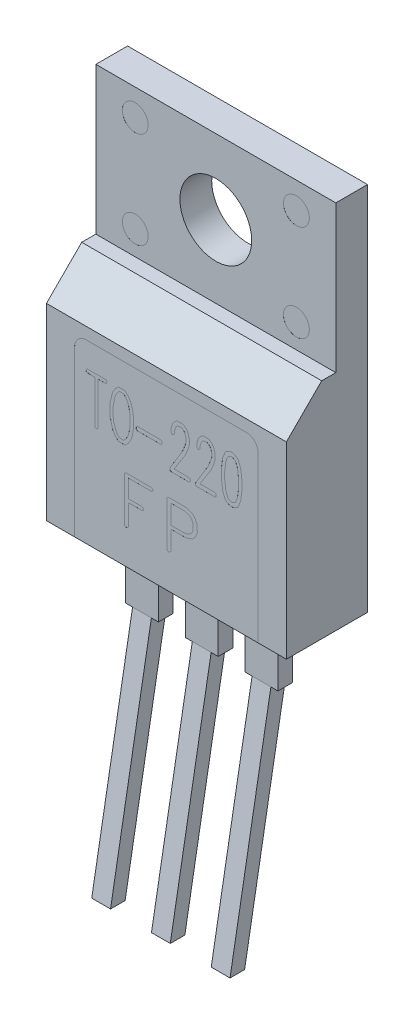
from build123d import *

# Parameters (mm, degrees)
SKETCH1_W           = 10.2
SKETCH1_H           = 15.75
SKETCH1_R           = 1.525
BOSS_EXTRUDE1_DEPTH = 1.35
SKETCH2_W           = 10.2
SKETCH2_H           = 9.5
BOSS_EXTRUDE2_DEPTH = 2.1
CHAMFER1_SIZE       = 1.5
CUT_EXTRUDE1_DEPTH  = 0.001
SKETCH4_W           = 1.4
SKETCH4_H           = 0.62
BOSS_EXTRUDE3_DEPTH = 2.85
SKETCH5_W           = 0.8
SKETCH5_H           = 0.62
BOSS_EXTRUDE4_DEPTH = 10
CUT_EXTRUDE2_DEPTH  = 0.001
SKETCH7_R           = 0.55
CUT_EXTRUDE3_DEPTH  = 0.001


with BuildPart() as part:
    # Sketch1 → Boss-Extrude1 (new body)
    with BuildSketch(Plane.XY):
        Rectangle(SKETCH1_W, SKETCH1_H)
        with Locations(Location((0, 4.7, 0), (0, 0, 180))):
            Circle(SKETCH1_R, mode=Mode.SUBTRACT)
    extrude(amount=BOSS_EXTRUDE1_DEPTH)

    # Sketch2 → Boss-Extrude2 (add)
    with BuildSketch(Plane.XY.offset(1.35)):
        with Locations((0, -3.125)):
            Rectangle(SKETCH2_W, SKETCH2_H)
    extrude(amount=BOSS_EXTRUDE2_DEPTH)

    # Chamfer1
    chamfer1_edges = [part.edges().sort_by_distance(p)[0] for p in [
        (0, 1.625, 3.45),
    ]]
    chamfer(chamfer1_edges, length=CHAMFER1_SIZE)

    # Sketch3 → Cut-Extrude1 (cut)
    with BuildSketch(Plane.XY.offset(3.45)):
        with BuildLine():
            Line((-3.9, -7.875), (3.9, -7.875))
            Line((3.9, -7.875), (3.9, -0.875))
            ThreePointArc((3.9, -0.875), (3.753553391, -0.521446609), (3.4, -0.375))
            Line((3.4, -0.375), (-3.4, -0.375))
            ThreePointArc((-3.4, -0.375), (-3.753553391, -0.521446609), (-3.9, -0.875))
            Line((-3.9, -0.875), (-3.9, -7.875))
        make_face()
    extrude(amount=-CUT_EXTRUDE1_DEPTH, mode=Mode.SUBTRACT)

    # Sketch4 → Boss-Extrude3 (add)
    with BuildSketch(Plane.XZ.offset(7.875)):
        with Locations((-2.54, 1.639)):
            Rectangle(SKETCH4_W, SKETCH4_H)
        with Locations((0, 1.639)):
            Rectangle(SKETCH4_W, SKETCH4_H)
        with Locations((2.54, 1.639)):
            Rectangle(SKETCH4_W, SKETCH4_H)
    extrude(amount=BOSS_EXTRUDE3_DEPTH)

    # Sketch5 → Boss-Extrude4 (add, along a direction that is not the sketch's normal)
    with BuildSketch(Plane.XZ.offset(10.725)):
        with Locations((-2.54, 1.639)):
            Rectangle(SKETCH5_W, SKETCH5_H)
        with Locations((2.54, 1.639)):
            Rectangle(SKETCH5_W, SKETCH5_H)
        with Locations((0, 1.639)):
            Rectangle(SKETCH5_W, SKETCH5_H)
    extrude(amount=BOSS_EXTRUDE4_DEPTH, dir=(0, -0.984807753012208, 0.17364817766693064))

    # Sketch6 → Cut-Extrude2 (cut)
    # profile 1 of 8: a face of its own
    with BuildSketch(Plane.XY.offset(3.449)):
        with BuildLine():
            add(Edge.make_bspline(
                [(-3.337053571, -1.553571429), (-3.344583859, -1.555083796), (-3.358084631, -1.557795263), (-3.376927269, -1.557912121), (-3.392215813, -1.553387595), (-3.405362186, -1.540412883), (-3.414351272, -1.519967594), (-3.41589508, -1.502685243), (-3.416666667, -1.494047619)],
                knots=[0, 0, 0, 0, 1.138141606, 2.040531624, 2.780009125, 3.431502412, 4.71627916, 6, 6, 6, 6], degree=3))
            add(Edge.make_bspline(
                [(-3.416666667, -1.494047619), (-3.415955255, -1.485487162), (-3.414521596, -1.468235861), (-3.404666849, -1.448597093), (-3.394260846, -1.435081439), (-3.38431118, -1.427810635), (-3.37298055, -1.423460993), (-3.36499444, -1.422906102), (-3.360863095, -1.422619048)],
                knots=[0, 0, 0, 0, 1.528507809, 3.080296578, 3.85483527, 4.570982135, 5.260745705, 6, 6, 6, 6], degree=3))
            Line((-3.360863095, -1.422619048), (-2.613467262, -1.422619048))
            add(Edge.make_bspline(
                [(-2.613467262, -1.422619048), (-2.606485162, -1.422815125), (-2.59355828, -1.423178148), (-2.575825567, -1.428053473), (-2.561244351, -1.436313287), (-2.548533817, -1.451534048), (-2.537353697, -1.470515), (-2.535182119, -1.48685483), (-2.53422619, -1.494047619)],
                knots=[0, 0, 0, 0, 1.05057451, 1.945067327, 2.750578307, 3.532262753, 4.913702687, 6, 6, 6, 6], degree=3))
            add(Edge.make_bspline(
                [(-2.53422619, -1.494047619), (-2.535175637, -1.501359799), (-2.537312403, -1.517816137), (-2.548355556, -1.536974442), (-2.56138378, -1.551775043), (-2.575807789, -1.560057824), (-2.593563867, -1.564912043), (-2.606487122, -1.565278344), (-2.613467262, -1.56547619)],
                knots=[0, 0, 0, 0, 1.103831219, 2.484213998, 3.251526589, 4.056421147, 4.950229448, 6, 6, 6, 6], degree=3))
            Line((-2.613467262, -1.56547619), (-2.904761905, -1.56547619))
            Line((-2.904761905, -1.56547619), (-2.904761905, -3.345238095))
            add(Edge.make_bspline(
                [(-2.904761905, -3.345238095), (-2.905783203, -3.353312761), (-2.908067564, -3.371373542), (-2.920112704, -3.39210117), (-2.93369168, -3.4082686), (-2.948913179, -3.41688488), (-2.967479812, -3.421576529), (-2.980872483, -3.422253794), (-2.988095238, -3.422619048)],
                knots=[0, 0, 0, 0, 1.142200586, 2.554785099, 3.31231341, 4.106525294, 4.978836614, 6, 6, 6, 6], degree=3))
            add(Edge.make_bspline(
                [(-2.988095238, -3.422619048), (-2.992477514, -3.422356854), (-3.000994974, -3.421847252), (-3.012982756, -3.417136995), (-3.023333729, -3.409295729), (-3.035092846, -3.395314638), (-3.0451181, -3.373493005), (-3.046786339, -3.354645774), (-3.047619048, -3.345238095)],
                knots=[0, 0, 0, 0, 0.726822302, 1.412663379, 2.105912496, 2.866784857, 4.436041716, 6, 6, 6, 6], degree=3))
            Line((-3.047619048, -3.345238095), (-3.047619048, -1.56547619))
            Line((-3.047619048, -1.56547619), (-3.313244048, -1.56547619))
            Line((-3.313244048, -1.56547619), (-3.337053571, -1.553571429))
        make_face()
    # profile 2 of 8: a face of its own
    with BuildSketch(Plane.XY.offset(3.449)):
        with BuildLine():
            add(Edge.make_bspline(
                [(-1.52641369, -1.713541667), (-1.521569557, -1.721139903), (-1.513281033, -1.734140818), (-1.509417878, -1.749023616), (-1.5078125, -1.755208333)],
                knots=[0, 0, 0, 0, 1.168877111, 2, 2, 2, 2], degree=3))
            Line((-1.5078125, -1.755208333), (-1.45610119, -1.905505952))
            Line((-1.45610119, -1.905505952), (-1.453869048, -1.909970238))
            add(Edge.make_bspline(
                [(-1.453869048, -1.909970238), (-1.452063818, -1.915881011), (-1.449118709, -1.925524034), (-1.447715658, -1.935499284), (-1.447172619, -1.939360119)],
                knots=[0, 0, 0, 0, 1.225917069, 2, 2, 2, 2], degree=3))
            Line((-1.447172619, -1.939360119), (-1.405133929, -2.181547619))
            add(Edge.make_bspline(
                [(-1.405133929, -2.181547619), (-1.404978098, -2.186383521), (-1.404674476, -2.195805821), (-1.404733281, -2.205232768), (-1.404761905, -2.209821429)],
                knots=[0, 0, 0, 0, 1.026479987, 2, 2, 2, 2], degree=3))
            Line((-1.404761905, -2.209821429), (-1.404761905, -2.635416667))
            add(Edge.make_bspline(
                [(-1.404761905, -2.635416667), (-1.404761905, -2.640252976), (-1.404761905, -2.648933532), (-1.404761905, -2.657614087), (-1.404761905, -2.661458333)],
                knots=[0, 0, 0, 0, 1.114285714, 2, 2, 2, 2], degree=3))
            Line((-1.404761905, -2.661458333), (-1.447544643, -2.911458333))
            add(Edge.make_bspline(
                [(-1.447544643, -2.911458333), (-1.448071758, -2.915076164), (-1.44923368, -2.923050959), (-1.451750148, -2.930710891), (-1.453125, -2.934895833)],
                knots=[0, 0, 0, 0, 0.907316161, 2, 2, 2, 2], degree=3))
            Line((-1.453125, -2.934895833), (-1.453497024, -2.936755952))
            Line((-1.453497024, -2.936755952), (-1.509672619, -3.099702381))
            add(Edge.make_bspline(
                [(-1.509672619, -3.099702381), (-1.511691149, -3.105142077), (-1.515068691, -3.114244148), (-1.520240473, -3.122444496), (-1.522321429, -3.125744048)],
                knots=[0, 0, 0, 0, 1.195265482, 2, 2, 2, 2], degree=3))
            Line((-1.522321429, -3.125744048), (-1.624255952, -3.292782738))
            add(Edge.make_bspline(
                [(-1.624255952, -3.292782738), (-1.62723118, -3.299355902), (-1.632872287, -3.311818787), (-1.645210746, -3.317586696), (-1.651041667, -3.3203125)],
                knots=[0, 0, 0, 0, 1.054838137, 2, 2, 2, 2], degree=3))
            Line((-1.651041667, -3.3203125), (-1.73139881, -3.390625))
            add(Edge.make_bspline(
                [(-1.73139881, -3.390625), (-1.734537434, -3.395659865), (-1.740792772, -3.405694444), (-1.756766619, -3.415360622), (-1.775867415, -3.422082236), (-1.790225752, -3.422430629), (-1.797991071, -3.422619048)],
                knots=[0, 0, 0, 0, 0.90300958, 1.799714995, 2.810035161, 4, 4, 4, 4], degree=3))
            Line((-1.797991071, -3.422619048), (-2.022693452, -3.422619048))
            add(Edge.make_bspline(
                [(-2.022693452, -3.422619048), (-2.027709633, -3.422288731), (-2.037186463, -3.42166468), (-2.050112034, -3.416239842), (-2.060400224, -3.407172238), (-2.064716239, -3.399227431), (-2.066964286, -3.395089286)],
                knots=[0, 0, 0, 0, 1.085042538, 2.049918853, 2.984277492, 4, 4, 4, 4], degree=3))
            Line((-2.066964286, -3.395089286), (-2.147693452, -3.324404762))
            add(Edge.make_bspline(
                [(-2.147693452, -3.324404762), (-2.150402352, -3.323464237), (-2.156134086, -3.321474188), (-2.163143173, -3.314428255), (-2.169950469, -3.30551817), (-2.173379568, -3.29820353), (-2.175223214, -3.294270833)],
                knots=[0, 0, 0, 0, 0.807126528, 1.707791034, 2.767600087, 4, 4, 4, 4], degree=3))
            Line((-2.175223214, -3.294270833), (-2.2734375, -3.133928571))
            add(Edge.make_bspline(
                [(-2.2734375, -3.133928571), (-2.277965155, -3.127710393), (-2.287061572, -3.115217583), (-2.289384089, -3.099936815), (-2.290550595, -3.092261905)],
                knots=[0, 0, 0, 0, 0.995481035, 2, 2, 2, 2], degree=3))
            Line((-2.290550595, -3.092261905), (-2.33296131, -2.939360119))
            add(Edge.make_bspline(
                [(-2.33296131, -2.939360119), (-2.333116325, -2.934648225), (-2.333426302, -2.925226069), (-2.333364319, -2.915799019), (-2.333333333, -2.91108631)],
                knots=[0, 0, 0, 0, 1.00017307, 2, 2, 2, 2], degree=3))
            Line((-2.333333333, -2.91108631), (-2.404389881, -2.668526786))
            add(Edge.make_bspline(
                [(-2.404389881, -2.668526786), (-2.404543154, -2.663318801), (-2.404867897, -2.652284484), (-2.404798531, -2.641245476), (-2.404761905, -2.635416667)],
                knots=[0, 0, 0, 0, 0.943961462, 2, 2, 2, 2], degree=3))
            Line((-2.404761905, -2.635416667), (-2.404761905, -2.209821429))
            add(Edge.make_bspline(
                [(-2.404761905, -2.209821429), (-2.404761905, -2.204985119), (-2.404761905, -2.194816468), (-2.404761905, -2.184647817), (-2.404761905, -2.179315476)],
                knots=[0, 0, 0, 0, 0.951219512, 2, 2, 2, 2], degree=3))
            Line((-2.404761905, -2.179315476), (-2.33296131, -1.937872024))
            add(Edge.make_bspline(
                [(-2.33296131, -1.937872024), (-2.333114363, -1.933284123), (-2.333441089, -1.923490235), (-2.333370732, -1.913690981), (-2.333333333, -1.908482143)],
                knots=[0, 0, 0, 0, 0.93689068, 2, 2, 2, 2], degree=3))
            Line((-2.333333333, -1.908482143), (-2.290550595, -1.754092262))
            add(Edge.make_bspline(
                [(-2.290550595, -1.754092262), (-2.289422524, -1.746157998), (-2.287235218, -1.730773621), (-2.278189869, -1.718161284), (-2.273809524, -1.712053571)],
                knots=[0, 0, 0, 0, 1.031470231, 2, 2, 2, 2], degree=3))
            Line((-2.273809524, -1.712053571), (-2.175967262, -1.552455357))
            add(Edge.make_bspline(
                [(-2.175967262, -1.552455357), (-2.172375166, -1.546111687), (-2.165712415, -1.534345214), (-2.15388732, -1.527897258), (-2.1484375, -1.524925595)],
                knots=[0, 0, 0, 0, 1.078261996, 2, 2, 2, 2], degree=3))
            Line((-2.1484375, -1.524925595), (-2.066964286, -1.450892857))
            add(Edge.make_bspline(
                [(-2.066964286, -1.450892857), (-2.064713149, -1.44664404), (-2.06039779, -1.438499187), (-2.050242823, -1.428969593), (-2.0371713, -1.423591128), (-2.027704385, -1.422955495), (-2.022693452, -1.422619048)],
                knots=[0, 0, 0, 0, 1.028115026, 1.970864985, 2.925958555, 4, 4, 4, 4], degree=3))
            Line((-2.022693452, -1.422619048), (-1.797991071, -1.422619048))
            add(Edge.make_bspline(
                [(-1.797991071, -1.422619048), (-1.79025041, -1.423007995), (-1.775829214, -1.423732621), (-1.756042842, -1.43003755), (-1.740139164, -1.441146508), (-1.733568214, -1.451612328), (-1.730282738, -1.456845238)],
                knots=[0, 0, 0, 0, 1.159625116, 2.160432893, 3.080216446, 4, 4, 4, 4], degree=3))
            Line((-1.730282738, -1.456845238), (-1.66108631, -1.525297619))
            add(Edge.make_bspline(
                [(-1.66108631, -1.525297619), (-1.653708193, -1.528191047), (-1.639575934, -1.533733203), (-1.630216935, -1.545645917), (-1.625744048, -1.551339286)],
                knots=[0, 0, 0, 0, 1.044152526, 2, 2, 2, 2], degree=3))
            Line((-1.625744048, -1.551339286), (-1.52641369, -1.713541667))
        make_face()
        Polygon((-1.735491071, -3.196800595), (-1.647693452, -3.049479167), (-1.593377976, -2.889508929), (-1.592633929, -2.88764881), (-1.547619048, -2.625744048), (-1.547619048, -2.219122024), (-1.59077381, -1.963169643), (-1.592261905, -1.962797619), (-1.647693452, -1.796130952), (-1.735863095, -1.648065476), (-1.82328869, -1.56547619), (-1.99516369, -1.56547619), (-2.073660714, -1.640997024), (-2.161458333, -1.788690476), (-2.230654762, -1.97172619), (-2.212425595, -1.980282738), (-2.261904762, -2.216145833), (-2.261904762, -2.629464286), (-2.231770833, -2.874627976), (-2.212797619, -2.864955357), (-2.16108631, -3.05766369), (-2.07328869, -3.204985119), (-1.99516369, -3.279761905), (-1.822916667, -3.279761905), align=None, mode=Mode.SUBTRACT)
    # profile 3 of 8: a face of its own
    with BuildSketch(Plane.XY.offset(3.449)):
        with BuildLine():
            add(Edge.make_bspline(
                [(-0.242559524, -2.470238095), (-0.236737568, -2.474185635), (-0.226183932, -2.481341459), (-0.213272553, -2.493136944), (-0.203729622, -2.504047557), (-0.200480381, -2.512056677), (-0.199032738, -2.515625)],
                knots=[0, 0, 0, 0, 1.31724091, 2.387802413, 3.2817136, 4, 4, 4, 4], degree=3))
            add(Edge.make_bspline(
                [(-0.199032738, -2.515625), (-0.196583303, -2.521121284), (-0.191620176, -2.532258038), (-0.190860796, -2.544430307), (-0.19047619, -2.550595238)],
                knots=[0, 0, 0, 0, 0.987053187, 2, 2, 2, 2], degree=3))
            add(Edge.make_bspline(
                [(-0.19047619, -2.550595238), (-0.19091643, -2.557681294), (-0.191839981, -2.572546708), (-0.196058783, -2.591268526), (-0.203257081, -2.606628522), (-0.213554845, -2.617296254), (-0.227165503, -2.627886404), (-0.238106154, -2.633730856), (-0.244047619, -2.636904762)],
                knots=[0, 0, 0, 0, 1.174378568, 2.463658788, 3.152065413, 3.951460674, 4.88751369, 6, 6, 6, 6], degree=3))
            Line((-0.244047619, -2.636904762), (-1.241071429, -2.636532738))
            add(Edge.make_bspline(
                [(-1.241071429, -2.636532738), (-1.24734748, -2.634300762), (-1.259764182, -2.629884964), (-1.273213436, -2.613896934), (-1.282931233, -2.593493896), (-1.284733205, -2.577520886), (-1.285714286, -2.568824405)],
                knots=[0, 0, 0, 0, 0.906075189, 1.792602544, 2.798185721, 4, 4, 4, 4], degree=3))
            add(Edge.make_bspline(
                [(-1.285714286, -2.568824405), (-1.285451022, -2.55972433), (-1.284953893, -2.542540389), (-1.278797169, -2.518739719), (-1.269464146, -2.498196875), (-1.259605446, -2.487878439), (-1.25483631, -2.482886905)],
                knots=[0, 0, 0, 0, 1.159043221, 2.188655717, 3.123763861, 4, 4, 4, 4], degree=3))
            add(Edge.make_bspline(
                [(-1.25483631, -2.482886905), (-1.253129302, -2.481118925), (-1.248728791, -2.476561234), (-1.243748056, -2.472638907), (-1.240699405, -2.470238095)],
                knots=[0, 0, 0, 0, 0.775822661, 2, 2, 2, 2], degree=3))
            Line((-1.240699405, -2.470238095), (-0.242559524, -2.470238095))
        make_face()
    # profile 4 of 8: a face of its own
    with BuildSketch(Plane.XY.offset(3.449)):
        with BuildLine():
            add(Edge.make_bspline(
                [(0.712797619, -1.425967262), (0.721071724, -1.432830569), (0.739542685, -1.448152091), (0.771108883, -1.472560513), (0.80836802, -1.501946549), (0.835535865, -1.522731405), (0.850074405, -1.533854167)],
                knots=[0, 0, 0, 0, 0.738755888, 1.649185221, 2.741990243, 4, 4, 4, 4], degree=3))
            add(Edge.make_bspline(
                [(0.850074405, -1.533854167), (0.857193904, -1.544858282), (0.873047273, -1.569361735), (0.892477062, -1.601527844), (0.908350096, -1.629507045), (0.918728797, -1.650289613), (0.925710778, -1.670383689), (0.928912669, -1.683506895), (0.930431548, -1.689732143)],
                knots=[0, 0, 0, 0, 1.337769255, 2.978882237, 3.834564883, 4.621482691, 5.346073539, 6, 6, 6, 6], degree=3))
            add(Edge.make_bspline(
                [(0.930431548, -1.689732143), (0.933181977, -1.698157575), (0.939596437, -1.717807084), (0.949886734, -1.751418374), (0.962103289, -1.793424669), (0.971211364, -1.824038271), (0.976190476, -1.84077381)],
                knots=[0, 0, 0, 0, 0.673862802, 1.571560152, 2.672444651, 4, 4, 4, 4], degree=3))
            Line((0.976190476, -1.84077381), (0.976190476, -2.039434524))
            add(Edge.make_bspline(
                [(0.976190476, -2.039434524), (0.975101474, -2.043286997), (0.972561426, -2.052272711), (0.967474239, -2.067373762), (0.962215138, -2.086520139), (0.954811778, -2.109036734), (0.94732854, -2.13562538), (0.93777712, -2.16548407), (0.927877074, -2.199333473), (0.92054654, -2.222977084), (0.916666667, -2.235491071)],
                knots=[0, 0, 0, 0, 0.468874405, 1.093627666, 1.865790236, 2.793814149, 3.869268999, 5.100575786, 6.465405363, 8, 8, 8, 8], degree=3))
            Line((0.916666667, -2.235491071), (0.802455357, -2.5078125))
            Line((0.802455357, -2.5078125), (0.329241071, -3.255952381))
            Line((0.329241071, -3.255952381), (0.962425595, -3.255952381))
            add(Edge.make_bspline(
                [(0.962425595, -3.255952381), (0.971316041, -3.261097314), (0.987996452, -3.270750327), (1.006936243, -3.291269739), (1.019316901, -3.314861065), (1.020323936, -3.332069239), (1.020833333, -3.34077381)],
                knots=[0, 0, 0, 0, 1.127991252, 2.116356953, 3.047179272, 4, 4, 4, 4], degree=3))
            add(Edge.make_bspline(
                [(1.020833333, -3.34077381), (1.019685126, -3.34761406), (1.016927856, -3.364040038), (1.012581216, -3.380123237), (1.010044643, -3.389508929)],
                knots=[0, 0, 0, 0, 0.832857648, 2, 2, 2, 2], degree=3))
            add(Edge.make_bspline(
                [(1.010044643, -3.389508929), (1.00702498, -3.394628813), (1.00094897, -3.404930779), (0.985445664, -3.415491928), (0.966324226, -3.421430631), (0.952430831, -3.422202766), (0.944940476, -3.422619048)],
                knots=[0, 0, 0, 0, 0.915320197, 1.841760097, 2.836426763, 4, 4, 4, 4], degree=3))
            Line((0.944940476, -3.422619048), (0.183407738, -3.422619048))
            add(Edge.make_bspline(
                [(0.183407738, -3.422619048), (0.177812532, -3.419610613), (0.166502935, -3.413529661), (0.15382021, -3.397462926), (0.145616222, -3.376553009), (0.143826435, -3.360824571), (0.142857143, -3.352306548)],
                knots=[0, 0, 0, 0, 0.883706095, 1.786236404, 2.801095743, 4, 4, 4, 4], degree=3))
            add(Edge.make_bspline(
                [(0.142857143, -3.352306548), (0.143495797, -3.339805127), (0.14473152, -3.315616334), (0.155507583, -3.293950493), (0.160714286, -3.283482143)],
                knots=[0, 0, 0, 0, 1.033653998, 2, 2, 2, 2], degree=3))
            Line((0.160714286, -3.283482143), (0.686383929, -2.420386905))
            Line((0.686383929, -2.420386905), (0.7890625, -2.162946429))
            Line((0.7890625, -2.162946429), (0.833333333, -2.018229167))
            Line((0.833333333, -2.018229167), (0.833333333, -1.876488095))
            Line((0.833333333, -1.876488095), (0.786458333, -1.725446429))
            Line((0.786458333, -1.725446429), (0.747395833, -1.658482143))
            Line((0.747395833, -1.658482143), (0.659970238, -1.589285714))
            Line((0.659970238, -1.589285714), (0.494791667, -1.589285714))
            Line((0.494791667, -1.589285714), (0.419270833, -1.651785714))
            Line((0.419270833, -1.651785714), (0.380580357, -1.716517857))
            Line((0.380580357, -1.716517857), (0.334077381, -1.870907738))
            Line((0.334077381, -1.870907738), (0.334077381, -1.933779762))
            add(Edge.make_bspline(
                [(0.334077381, -1.933779762), (0.33374097, -1.941420313), (0.333078192, -1.956473288), (0.324971687, -1.977704016), (0.312989948, -1.997361234), (0.301628556, -2.007931796), (0.295758929, -2.013392857)],
                knots=[0, 0, 0, 0, 0.999430391, 1.969020288, 2.950736492, 4, 4, 4, 4], degree=3))
            add(Edge.make_bspline(
                [(0.295758929, -2.013392857), (0.288121108, -2.015733333), (0.274584737, -2.019881316), (0.260570896, -2.021839961), (0.254464286, -2.022693452)],
                knots=[0, 0, 0, 0, 1.128488755, 2, 2, 2, 2], degree=3))
            add(Edge.make_bspline(
                [(0.254464286, -2.022693452), (0.249953065, -2.022589007), (0.24145158, -2.022392177), (0.229993388, -2.018027853), (0.220377992, -2.011539361), (0.216096978, -2.005375611), (0.21391369, -2.002232143)],
                knots=[0, 0, 0, 0, 1.128025163, 2.125785883, 3.044164124, 4, 4, 4, 4], degree=3))
            add(Edge.make_bspline(
                [(0.21391369, -2.002232143), (0.21064577, -1.997532578), (0.203427027, -1.987151375), (0.198528698, -1.966577558), (0.193961069, -1.941806715), (0.193872773, -1.923401051), (0.193824405, -1.913318452)],
                knots=[0, 0, 0, 0, 0.735272304, 1.624195484, 2.698537447, 4, 4, 4, 4], degree=3))
            add(Edge.make_bspline(
                [(0.193824405, -1.913318452), (0.195254151, -1.912473433), (0.19795684, -1.91087607), (0.199049327, -1.905696939), (0.197629034, -1.899908841), (0.195211492, -1.896137218), (0.193824405, -1.893973214)],
                knots=[0, 0, 0, 0, 0.85238152, 1.611280165, 2.62944954, 4, 4, 4, 4], degree=3))
            add(Edge.make_bspline(
                [(0.193824405, -1.893973214), (0.194258055, -1.884178191), (0.195081201, -1.865585514), (0.195238208, -1.8469755), (0.1953125, -1.838169643)],
                knots=[0, 0, 0, 0, 1.053643116, 2, 2, 2, 2], degree=3))
            add(Edge.make_bspline(
                [(0.1953125, -1.838169643), (0.199165068, -1.825399317), (0.207652386, -1.797265926), (0.221290486, -1.751345048), (0.237356592, -1.697880712), (0.248990254, -1.659840861), (0.255208333, -1.639508929)],
                knots=[0, 0, 0, 0, 0.771421305, 1.699463078, 2.770385237, 4, 4, 4, 4], degree=3))
            add(Edge.make_bspline(
                [(0.255208333, -1.639508929), (0.262582703, -1.626449449), (0.276848727, -1.601185346), (0.291856948, -1.576355137), (0.299107143, -1.564360119)],
                knots=[0, 0, 0, 0, 1.033836784, 2, 2, 2, 2], degree=3))
            add(Edge.make_bspline(
                [(0.299107143, -1.564360119), (0.304066946, -1.55657992), (0.313257967, -1.542162417), (0.327603119, -1.523709927), (0.340881795, -1.50934686), (0.350804323, -1.503419356), (0.355282738, -1.500744048)],
                knots=[0, 0, 0, 0, 1.289706312, 2.389957182, 3.273326239, 4, 4, 4, 4], degree=3))
            Line((0.355282738, -1.500744048), (0.445684524, -1.428943452))
            Line((0.445684524, -1.428943452), (0.462053571, -1.422991071))
            Line((0.462053571, -1.422991071), (0.712797619, -1.425967262))
        make_face()
    # profile 5 of 8: a face of its own
    with BuildSketch(Plane.XY.offset(3.449)):
        with BuildLine():
            add(Edge.make_bspline(
                [(1.808035714, -1.425967262), (1.816309819, -1.432830569), (1.83478078, -1.448152091), (1.866346978, -1.472560513), (1.903606116, -1.501946549), (1.93077396, -1.522731405), (1.9453125, -1.533854167)],
                knots=[0, 0, 0, 0, 0.738755888, 1.649185221, 2.741990243, 4, 4, 4, 4], degree=3))
            add(Edge.make_bspline(
                [(1.9453125, -1.533854167), (1.952431999, -1.544858282), (1.968285368, -1.569361735), (1.987715157, -1.601527844), (2.003588191, -1.629507045), (2.013966892, -1.650289613), (2.020948873, -1.670383689), (2.024150764, -1.683506895), (2.025669643, -1.689732143)],
                knots=[0, 0, 0, 0, 1.337769255, 2.978882237, 3.834564883, 4.621482691, 5.346073539, 6, 6, 6, 6], degree=3))
            add(Edge.make_bspline(
                [(2.025669643, -1.689732143), (2.028420073, -1.698157575), (2.034834533, -1.717807084), (2.045124829, -1.751418374), (2.057341385, -1.793424669), (2.06644946, -1.824038271), (2.071428571, -1.84077381)],
                knots=[0, 0, 0, 0, 0.673862802, 1.571560152, 2.672444651, 4, 4, 4, 4], degree=3))
            Line((2.071428571, -1.84077381), (2.071428571, -2.039434524))
            add(Edge.make_bspline(
                [(2.071428571, -2.039434524), (2.070339569, -2.043286997), (2.067799522, -2.052272711), (2.062712334, -2.067373762), (2.057453234, -2.086520139), (2.050049873, -2.109036734), (2.042566636, -2.13562538), (2.033015215, -2.16548407), (2.023115169, -2.199333473), (2.015784635, -2.222977084), (2.011904762, -2.235491071)],
                knots=[0, 0, 0, 0, 0.468874405, 1.093627666, 1.865790236, 2.793814149, 3.869268999, 5.100575786, 6.465405363, 8, 8, 8, 8], degree=3))
            Line((2.011904762, -2.235491071), (1.897693452, -2.5078125))
            Line((1.897693452, -2.5078125), (1.424479167, -3.255952381))
            Line((1.424479167, -3.255952381), (2.05766369, -3.255952381))
            add(Edge.make_bspline(
                [(2.05766369, -3.255952381), (2.066554137, -3.261097314), (2.083234548, -3.270750327), (2.102174338, -3.291269739), (2.114554997, -3.314861065), (2.115562031, -3.332069239), (2.116071429, -3.34077381)],
                knots=[0, 0, 0, 0, 1.127991252, 2.116356953, 3.047179272, 4, 4, 4, 4], degree=3))
            add(Edge.make_bspline(
                [(2.116071429, -3.34077381), (2.114923222, -3.34761406), (2.112165951, -3.364040038), (2.107819312, -3.380123237), (2.105282738, -3.389508929)],
                knots=[0, 0, 0, 0, 0.832857648, 2, 2, 2, 2], degree=3))
            add(Edge.make_bspline(
                [(2.105282738, -3.389508929), (2.102263075, -3.394628813), (2.096187066, -3.404930779), (2.080683759, -3.415491928), (2.061562321, -3.421430631), (2.047668926, -3.422202766), (2.040178571, -3.422619048)],
                knots=[0, 0, 0, 0, 0.915320197, 1.841760097, 2.836426763, 4, 4, 4, 4], degree=3))
            Line((2.040178571, -3.422619048), (1.278645833, -3.422619048))
            add(Edge.make_bspline(
                [(1.278645833, -3.422619048), (1.273050627, -3.419610613), (1.26174103, -3.413529661), (1.249058306, -3.397462926), (1.240854317, -3.376553009), (1.23906453, -3.360824571), (1.238095238, -3.352306548)],
                knots=[0, 0, 0, 0, 0.883706095, 1.786236404, 2.801095743, 4, 4, 4, 4], degree=3))
            add(Edge.make_bspline(
                [(1.238095238, -3.352306548), (1.238733893, -3.339805127), (1.239969615, -3.315616334), (1.250745678, -3.293950493), (1.255952381, -3.283482143)],
                knots=[0, 0, 0, 0, 1.033653998, 2, 2, 2, 2], degree=3))
            Line((1.255952381, -3.283482143), (1.781622024, -2.420386905))
            Line((1.781622024, -2.420386905), (1.884300595, -2.162946429))
            Line((1.884300595, -2.162946429), (1.928571429, -2.018229167))
            Line((1.928571429, -2.018229167), (1.928571429, -1.876488095))
            Line((1.928571429, -1.876488095), (1.881696429, -1.725446429))
            Line((1.881696429, -1.725446429), (1.842633929, -1.658482143))
            Line((1.842633929, -1.658482143), (1.755208333, -1.589285714))
            Line((1.755208333, -1.589285714), (1.590029762, -1.589285714))
            Line((1.590029762, -1.589285714), (1.514508929, -1.651785714))
            Line((1.514508929, -1.651785714), (1.475818452, -1.716517857))
            Line((1.475818452, -1.716517857), (1.429315476, -1.870907738))
            Line((1.429315476, -1.870907738), (1.429315476, -1.933779762))
            add(Edge.make_bspline(
                [(1.429315476, -1.933779762), (1.428979065, -1.941420313), (1.428316287, -1.956473288), (1.420209782, -1.977704016), (1.408228044, -1.997361234), (1.396866651, -2.007931796), (1.390997024, -2.013392857)],
                knots=[0, 0, 0, 0, 0.999430391, 1.969020288, 2.950736492, 4, 4, 4, 4], degree=3))
            add(Edge.make_bspline(
                [(1.390997024, -2.013392857), (1.383359203, -2.015733333), (1.369822832, -2.019881316), (1.355808991, -2.021839961), (1.349702381, -2.022693452)],
                knots=[0, 0, 0, 0, 1.128488755, 2, 2, 2, 2], degree=3))
            add(Edge.make_bspline(
                [(1.349702381, -2.022693452), (1.34519116, -2.022589007), (1.336689675, -2.022392177), (1.325231484, -2.018027853), (1.315616088, -2.011539361), (1.311335073, -2.005375611), (1.309151786, -2.002232143)],
                knots=[0, 0, 0, 0, 1.128025163, 2.125785883, 3.044164124, 4, 4, 4, 4], degree=3))
            add(Edge.make_bspline(
                [(1.309151786, -2.002232143), (1.305883865, -1.997532578), (1.298665123, -1.987151375), (1.293766793, -1.966577558), (1.289199165, -1.941806715), (1.289110868, -1.923401051), (1.2890625, -1.913318452)],
                knots=[0, 0, 0, 0, 0.735272304, 1.624195484, 2.698537447, 4, 4, 4, 4], degree=3))
            add(Edge.make_bspline(
                [(1.2890625, -1.913318452), (1.290492246, -1.912473433), (1.293194935, -1.91087607), (1.294287422, -1.905696939), (1.292867129, -1.899908841), (1.290449587, -1.896137218), (1.2890625, -1.893973214)],
                knots=[0, 0, 0, 0, 0.85238152, 1.611280165, 2.62944954, 4, 4, 4, 4], degree=3))
            add(Edge.make_bspline(
                [(1.2890625, -1.893973214), (1.289496151, -1.884178191), (1.290319296, -1.865585514), (1.290476303, -1.8469755), (1.290550595, -1.838169643)],
                knots=[0, 0, 0, 0, 1.053643116, 2, 2, 2, 2], degree=3))
            add(Edge.make_bspline(
                [(1.290550595, -1.838169643), (1.294403163, -1.825399317), (1.302890481, -1.797265926), (1.316528581, -1.751345048), (1.332594688, -1.697880712), (1.344228349, -1.659840861), (1.350446429, -1.639508929)],
                knots=[0, 0, 0, 0, 0.771421305, 1.699463078, 2.770385237, 4, 4, 4, 4], degree=3))
            add(Edge.make_bspline(
                [(1.350446429, -1.639508929), (1.357820799, -1.626449449), (1.372086822, -1.601185346), (1.387095043, -1.576355137), (1.394345238, -1.564360119)],
                knots=[0, 0, 0, 0, 1.033836784, 2, 2, 2, 2], degree=3))
            add(Edge.make_bspline(
                [(1.394345238, -1.564360119), (1.399305042, -1.55657992), (1.408496063, -1.542162417), (1.422841214, -1.523709927), (1.43611989, -1.50934686), (1.446042418, -1.503419356), (1.450520833, -1.500744048)],
                knots=[0, 0, 0, 0, 1.289706312, 2.389957182, 3.273326239, 4, 4, 4, 4], degree=3))
            Line((1.450520833, -1.500744048), (1.540922619, -1.428943452))
            Line((1.540922619, -1.428943452), (1.557291667, -1.422991071))
            Line((1.557291667, -1.422991071), (1.808035714, -1.425967262))
        make_face()
    # profile 6 of 8: a face of its own
    with BuildSketch(Plane.XY.offset(3.449)):
        with BuildLine():
            add(Edge.make_bspline(
                [(2.84375, -1.425967262), (2.855004825, -1.432592189), (2.880325289, -1.447496572), (2.923386766, -1.471065428), (2.974951014, -1.499851499), (3.012501875, -1.520254688), (3.032738095, -1.53125)],
                knots=[0, 0, 0, 0, 0.724351583, 1.629604892, 2.722590218, 4, 4, 4, 4], degree=3))
            Line((3.032738095, -1.53125), (3.049479167, -1.558407738))
            Line((3.049479167, -1.558407738), (3.155505952, -1.824032738))
            Line((3.155505952, -1.824032738), (3.16108631, -1.847470238))
            Line((3.16108631, -1.847470238), (3.214285714, -2.294642857))
            Line((3.214285714, -2.294642857), (3.214285714, -2.563616071))
            Line((3.214285714, -2.563616071), (3.159598214, -3.017485119))
            Line((3.159598214, -3.017485119), (3.154017857, -3.032738095))
            Line((3.154017857, -3.032738095), (3.038690476, -3.307291667))
            Line((3.038690476, -3.307291667), (3.027901786, -3.319568452))
            add(Edge.make_bspline(
                [(3.027901786, -3.319568452), (3.012806082, -3.32670875), (2.979488491, -3.342468037), (2.938521858, -3.365945342), (2.904358897, -3.385858428), (2.880873498, -3.399754931), (2.860294748, -3.411583428), (2.847708481, -3.419130196), (2.841889881, -3.422619048)],
                knots=[0, 0, 0, 0, 1.412396496, 3.117287638, 3.991835281, 4.758389455, 5.426006563, 6, 6, 6, 6], degree=3))
            Line((2.841889881, -3.422619048), (2.693452381, -3.422619048))
            add(Edge.make_bspline(
                [(2.693452381, -3.422619048), (2.681887414, -3.416602255), (2.656484227, -3.403385988), (2.615592762, -3.380299229), (2.567524884, -3.353748356), (2.533449878, -3.334134827), (2.515252976, -3.323660714)],
                knots=[0, 0, 0, 0, 0.767374702, 1.68558742, 2.764045988, 4, 4, 4, 4], degree=3))
            Line((2.515252976, -3.323660714), (2.499627976, -3.302455357))
            Line((2.499627976, -3.302455357), (2.390252976, -3.02641369))
            Line((2.390252976, -3.02641369), (2.386160714, -3.006696429))
            Line((2.386160714, -3.006696429), (2.333333333, -2.561011905))
            Line((2.333333333, -2.561011905), (2.333333333, -2.274181548))
            Line((2.333333333, -2.274181548), (2.386532738, -1.829241071))
            Line((2.386532738, -1.829241071), (2.392485119, -1.808779762))
            Line((2.392485119, -1.808779762), (2.503348214, -1.540922619))
            Line((2.503348214, -1.540922619), (2.518229167, -1.52046131))
            add(Edge.make_bspline(
                [(2.518229167, -1.52046131), (2.524327338, -1.517653754), (2.537630402, -1.511529115), (2.558693428, -1.50056682), (2.582994533, -1.488017901), (2.609148753, -1.473500395), (2.635414741, -1.458950164), (2.659842835, -1.445430504), (2.681241231, -1.433548805), (2.694685251, -1.426326075), (2.700892857, -1.422991071)],
                knots=[0, 0, 0, 0, 0.777935742, 1.697054373, 2.751299037, 3.947613068, 5.16345026, 6.231321251, 7.18333501, 8, 8, 8, 8], degree=3))
            Line((2.700892857, -1.422991071), (2.84375, -1.425967262))
        make_face()
        Polygon((2.930059524, -1.65625), (2.805803571, -1.589285714), (2.728422619, -1.589285714), (2.616815476, -1.651041667), (2.524553571, -1.87797619), (2.476190476, -2.283854167), (2.476190476, -2.550967262), (2.526785714, -2.96577381), (2.618303571, -3.194568452), (2.728050595, -3.255952381), (2.805059524, -3.255952381), (2.931547619, -3.184895833), (3.022693452, -2.960193452), (3.071428571, -2.54985119), (3.071428571, -2.305803571), (3.020833333, -1.882440476), align=None, mode=Mode.SUBTRACT)
    # profile 7 of 8: a face of its own
    with BuildSketch(Plane.XY.offset(3.449)):
        with BuildLine():
            add(Edge.make_bspline(
                [(-0.647172619, -4.42485119), (-0.636827041, -4.428043613), (-0.618321723, -4.433753954), (-0.595395896, -4.446830233), (-0.579271253, -4.46278168), (-0.576116477, -4.475936219), (-0.574627976, -4.482142857)],
                knots=[0, 0, 0, 0, 1.323785726, 2.367878737, 3.229924671, 4, 4, 4, 4], degree=3))
            add(Edge.make_bspline(
                [(-0.574627976, -4.482142857), (-0.57494562, -4.489051834), (-0.575574618, -4.502733008), (-0.584084811, -4.521787863), (-0.597154073, -4.538877003), (-0.60896128, -4.547528), (-0.615178571, -4.552083333)],
                knots=[0, 0, 0, 0, 0.974871495, 1.930443064, 2.910238585, 4, 4, 4, 4], degree=3))
            add(Edge.make_bspline(
                [(-0.615178571, -4.552083333), (-0.618058705, -4.554256112), (-0.624602148, -4.559192497), (-0.638698847, -4.562729694), (-0.656607616, -4.565280256), (-0.670218506, -4.565406821), (-0.677678571, -4.56547619)],
                knots=[0, 0, 0, 0, 0.659063234, 1.49734101, 2.628304186, 4, 4, 4, 4], degree=3))
            Line((-0.677678571, -4.56547619), (-1.616666667, -4.56547619))
            Line((-1.616666667, -4.56547619), (-1.616666667, -5.327380952))
            Line((-1.616666667, -5.327380952), (-1.043377976, -5.327380952))
            add(Edge.make_bspline(
                [(-1.043377976, -5.327380952), (-1.035997232, -5.33060539), (-1.022506618, -5.336499057), (-1.005152232, -5.346136806), (-0.991876039, -5.354722149), (-0.981763354, -5.366002943), (-0.974230796, -5.37935463), (-0.972663356, -5.390420796), (-0.971949405, -5.39546131)],
                knots=[0, 0, 0, 0, 1.385850027, 2.533073688, 3.421965961, 4.08717946, 5.128731831, 6, 6, 6, 6], degree=3))
            add(Edge.make_bspline(
                [(-0.971949405, -5.39546131), (-0.972603348, -5.402190327), (-0.97401364, -5.416702106), (-0.981871883, -5.429028927), (-0.98608631, -5.435639881)],
                knots=[0, 0, 0, 0, 0.927387056, 2, 2, 2, 2], degree=3))
            add(Edge.make_bspline(
                [(-0.98608631, -5.435639881), (-0.991988777, -5.440953178), (-1.003231171, -5.451073382), (-1.022169111, -5.462071391), (-1.041446477, -5.468784218), (-1.054490457, -5.469760925), (-1.060863095, -5.470238095)],
                knots=[0, 0, 0, 0, 1.126805387, 2.146219525, 3.094335219, 4, 4, 4, 4], degree=3))
            Line((-1.060863095, -5.470238095), (-1.616666667, -5.470238095))
            Line((-1.616666667, -5.470238095), (-1.616666667, -6.356026786))
            add(Edge.make_bspline(
                [(-1.616666667, -6.356026786), (-1.618668191, -6.362405572), (-1.622862531, -6.375772782), (-1.636885547, -6.393197488), (-1.655492782, -6.409674682), (-1.67088916, -6.418093087), (-1.679166667, -6.422619048)],
                knots=[0, 0, 0, 0, 0.845387553, 1.771571109, 2.801936792, 4, 4, 4, 4], degree=3))
            Line((-1.679166667, -6.422619048), (-1.711904762, -6.422619048))
            add(Edge.make_bspline(
                [(-1.711904762, -6.422619048), (-1.717153644, -6.422501573), (-1.727333919, -6.42227373), (-1.741422761, -6.417780938), (-1.754339971, -6.412050415), (-1.764652189, -6.402857726), (-1.772968675, -6.391958614), (-1.778865258, -6.379521201), (-1.782877322, -6.365820686), (-1.783177775, -6.356181233), (-1.783333333, -6.351190476)],
                knots=[0, 0, 0, 0, 1.101665817, 2.136695196, 3.096220978, 4.06108244, 5.013447482, 5.972973263, 6.950521542, 8, 8, 8, 8], degree=3))
            Line((-1.783333333, -6.351190476), (-1.783333333, -4.480282738))
            add(Edge.make_bspline(
                [(-1.783333333, -4.480282738), (-1.780980293, -4.473638623), (-1.776316667, -4.460470268), (-1.762390738, -4.443819178), (-1.743471693, -4.430995747), (-1.728674543, -4.425520471), (-1.720833333, -4.422619048)],
                knots=[0, 0, 0, 0, 0.94585727, 1.874649088, 2.873747762, 4, 4, 4, 4], degree=3))
            Line((-1.720833333, -4.422619048), (-0.647172619, -4.42485119))
        make_face()
    # profile 8 of 8: a face of its own
    with BuildSketch(Plane.XY.offset(3.449)):
        with BuildLine():
            add(Edge.make_bspline(
                [(0.840997024, -4.422619048), (0.848679702, -4.425610409), (0.864883197, -4.431919473), (0.890826692, -4.441650205), (0.919750112, -4.452359129), (0.951568789, -4.464279128), (0.986448095, -4.476962771), (1.024120851, -4.49067495), (1.064945252, -4.505236792), (1.093104434, -4.515255055), (1.107738095, -4.52046131)],
                knots=[0, 0, 0, 0, 0.696396136, 1.468765226, 2.340441263, 3.301613602, 4.338829148, 5.475379787, 6.68801458, 8, 8, 8, 8], degree=3))
            add(Edge.make_bspline(
                [(1.107738095, -4.52046131), (1.113469367, -4.526014671), (1.127640524, -4.539745927), (1.151900895, -4.564979602), (1.183238742, -4.59862425), (1.206234433, -4.623976566), (1.218973214, -4.638020833)],
                knots=[0, 0, 0, 0, 0.591563996, 1.462702654, 2.594428976, 4, 4, 4, 4], degree=3))
            Line((1.218973214, -4.638020833), (1.307142857, -4.834077381))
            add(Edge.make_bspline(
                [(1.307142857, -4.834077381), (1.307422581, -4.842633241), (1.308014357, -4.860733742), (1.308278171, -4.889508976), (1.308506732, -4.921382627), (1.309659083, -4.956343544), (1.309201462, -4.994421521), (1.30979497, -5.035589829), (1.310208949, -5.07986027), (1.310149657, -5.110366955), (1.310119048, -5.126116071)],
                knots=[0, 0, 0, 0, 0.703416185, 1.488124494, 2.364537298, 3.322628907, 4.362024991, 5.493178395, 6.705849974, 8, 8, 8, 8], degree=3))
            add(Edge.make_bspline(
                [(1.310119048, -5.126116071), (1.303669283, -5.139880237), (1.289851081, -5.16936907), (1.267749505, -5.21661449), (1.243861129, -5.270128549), (1.226808076, -5.307673881), (1.217857143, -5.327380952)],
                knots=[0, 0, 0, 0, 0.823843001, 1.765030202, 2.826892511, 4, 4, 4, 4], degree=3))
            Line((1.217857143, -5.327380952), (1.1140625, -5.440848214))
            add(Edge.make_bspline(
                [(1.1140625, -5.440848214), (1.09494895, -5.44737393), (1.053786411, -5.461427576), (0.987673464, -5.485174532), (0.912501179, -5.512142361), (0.859342436, -5.531476401), (0.831324405, -5.541666667)],
                knots=[0, 0, 0, 0, 0.807375811, 1.738747617, 2.808176466, 4, 4, 4, 4], degree=3))
            Line((0.831324405, -5.541666667), (0.188095238, -5.541666667))
            Line((0.188095238, -5.541666667), (0.188095238, -6.352306548))
            add(Edge.make_bspline(
                [(0.188095238, -6.352306548), (0.186044309, -6.358653087), (0.181759891, -6.37191109), (0.168606027, -6.389932881), (0.150710708, -6.407332539), (0.13607478, -6.417271201), (0.128199405, -6.422619048)],
                knots=[0, 0, 0, 0, 0.841964727, 1.758875127, 2.794084094, 4, 4, 4, 4], degree=3))
            Line((0.128199405, -6.422619048), (0.092857143, -6.422619048))
            add(Edge.make_bspline(
                [(0.092857143, -6.422619048), (0.087608261, -6.422501573), (0.077427986, -6.42227373), (0.063339144, -6.417780938), (0.050421934, -6.412050415), (0.040109716, -6.402857726), (0.03179323, -6.391958614), (0.025896647, -6.379521201), (0.021884583, -6.365820686), (0.021584129, -6.356181233), (0.021428571, -6.351190476)],
                knots=[0, 0, 0, 0, 1.101665817, 2.136695196, 3.096220978, 4.06108244, 5.013447482, 5.972973263, 6.950521542, 8, 8, 8, 8], degree=3))
            Line((0.021428571, -6.351190476), (0.021428571, -4.47953869))
            add(Edge.make_bspline(
                [(0.021428571, -4.47953869), (0.024259636, -4.472015462), (0.029621131, -4.457767907), (0.043744253, -4.440064652), (0.062155461, -4.427504212), (0.076559048, -4.424272525), (0.083928571, -4.422619048)],
                knots=[0, 0, 0, 0, 1.07354319, 2.033085097, 2.993637732, 4, 4, 4, 4], degree=3))
            Line((0.083928571, -4.422619048), (0.840997024, -4.422619048))
        make_face()
        Polygon((1.008779762, -4.660714286), (0.8015625, -4.5859375), (0.188095238, -4.583333333), (0.188095238, -5.398809524), (0.798214286, -5.398809524), (1.008779762, -5.321800595), (1.065699405, -5.256324405), (1.137127976, -5.105282738), (1.137127976, -4.880208333), (1.067931548, -4.728794643), align=None, mode=Mode.SUBTRACT)
    extrude(amount=-CUT_EXTRUDE2_DEPTH, mode=Mode.SUBTRACT)

    # Sketch7 → Cut-Extrude3 (cut)
    with BuildSketch(Plane.XY.offset(1.35)):
        with Locations((-3.425, 6.75)):
            Circle(SKETCH7_R)
        with Locations(Location((3.425, 6.75, 0), (0, 0, 180))):
            Circle(SKETCH7_R)
        with Locations(Location((-3.425, 2.65, 0), (0, 0, 180))):
            Circle(SKETCH7_R)
        with Locations((3.425, 2.65)):
            Circle(SKETCH7_R)
    extrude(amount=-CUT_EXTRUDE3_DEPTH, mode=Mode.SUBTRACT)


solid = part.part
